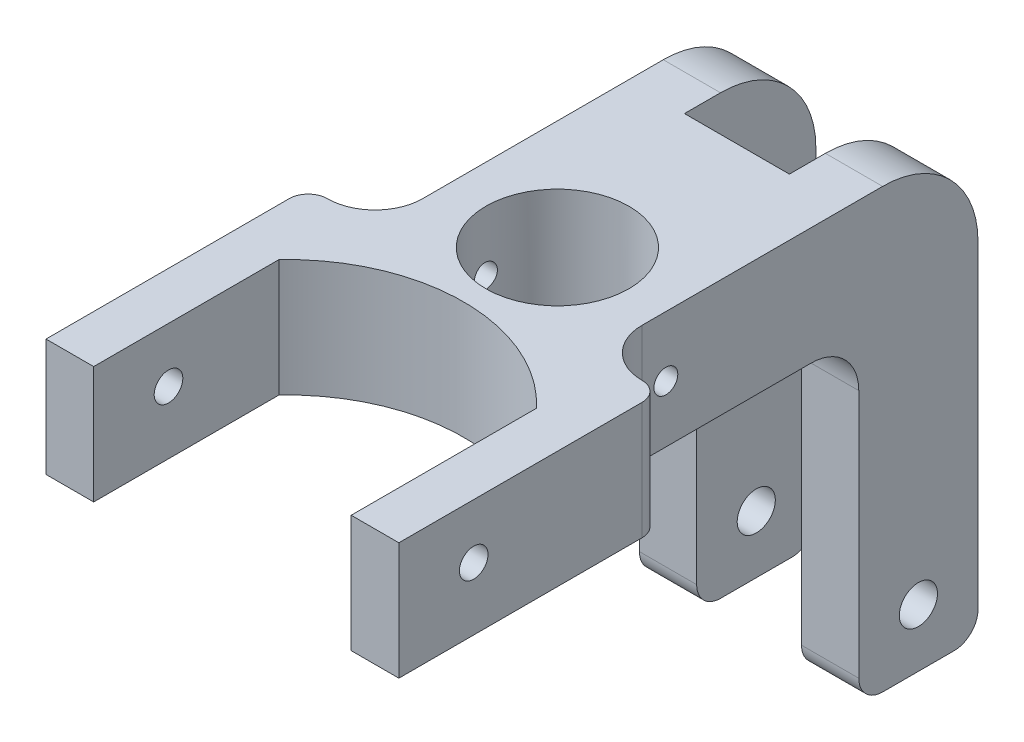
from build123d import *

# Parameters (mm, degrees)
EXTRUDE_START         = -3
EXTRUDE_1_DEPTH       = 46
SKETCH_2_R            = 15
SKETCH_2_W            = 22
SKETCH_2_H            = 41.003909118
CUT_EXTRUDE_2_DEPTH   = 120
SKETCH_3_R            = 4
SKETCH_3_R_2          = 2.5
CUT_EXTRUDE_1_DEPTH   = 55
SKETCH_4_W            = 74
SKETCH_4_H            = 24.59688775
EXTRUDE_3_DEPTH       = 55
CUT_EXTRUDE_2_2_DEPTH = 50
FILLET_2_R            = 4
SKETCH_7_R            = 3
CUT_EXTRUDE_3_DEPTH   = 90
FILLET_3_R            = 10


with BuildPart() as part:
    # Эскиз1 → Вытянуть1 (new body)
    with BuildSketch(Plane(origin=(0, 0, 0), x_dir=(0, 0, -1), z_dir=(1, 0, 0)).offset(EXTRUDE_START)):
        with BuildLine():
            Line((3.683652722, 0), (3.683652722, -24.59688775))
            Line((3.683652722, -24.59688775), (49.132150834, -24.59688775))
            ThreePointArc((49.132150834, -24.59688775), (56.203219269, -27.52582056), (59.132150834, -34.59688951))
            Line((59.132150834, -34.59688951), (59.132141638, -86.831595085))
            ThreePointArc((59.132141638, -86.831595085), (60.596607421, -90.36712956), (64.132141638, -91.831595966))
            Line((64.132141638, -91.831595966), (79.132150834, -91.831595966))
            ThreePointArc((79.132150834, -91.831595966), (82.66768474, -90.367129871), (84.132150834, -86.831595966))
            Line((84.132150834, -86.831595966), (84.132150834, -20))
            ThreePointArc((84.132150834, -20), (78.274286458, -5.857864376), (64.132150834, 0))
            Line((64.132150834, 0), (3.683652722, 0))
        make_face()
    extrude(amount=EXTRUDE_1_DEPTH)

    # Эскиз2 → Cut-Extrude 2 (cut, symmetric)
    with BuildSketch(Plane(origin=(0, 0, 0), x_dir=(1, 0, 0), z_dir=(0, 1, 0))):
        with Locations(Location((20, 18.931682227, 0), (0, 0, 270))):
            Circle(SKETCH_2_R)
        with Locations((20, 77.079487522)):
            Rectangle(SKETCH_2_W, SKETCH_2_H)
    extrude(amount=CUT_EXTRUDE_2_DEPTH, both=True, mode=Mode.SUBTRACT)

    # Эскиз3 → Вырез-Вытянуть1 (cut, symmetric)
    with BuildSketch(Plane(origin=(0, 0, 0), x_dir=(0, 0, -1), z_dir=(1, 0, 0))):
        with Locations((71.632122158, -79.695359499)):
            Circle(SKETCH_3_R)
        with Locations((18.675004926, -12.628238718)):
            Circle(SKETCH_3_R_2)
    extrude(amount=CUT_EXTRUDE_1_DEPTH, both=True, mode=Mode.SUBTRACT)

    # Эскиз4 → Вытянуть3 (add)
    with BuildSketch(Plane.XY.offset(-3.683652722)):
        with Locations((20.003387868, -12.298443875)):
            Rectangle(SKETCH_4_W, SKETCH_4_H)
    extrude(amount=EXTRUDE_3_DEPTH)

    # Эскиз6 → Cut-Extrude 2 2 (cut, symmetric)
    with BuildSketch(Plane(origin=(0, 0, 0), x_dir=(1, 0, 0), z_dir=(0, 1, 0))):
        with BuildLine():
            Line((47.003387868, -53.712819086), (47.003387868, -12.467045061))
            ThreePointArc((47.003387868, -12.467045061), (20.003387863, -0.765266352), (-6.996612132, -12.467045083))
            Line((-6.996612132, -12.467045083), (-6.996612132, -53.712819086))
            Line((-6.996612132, -53.712819086), (47.003387868, -53.712819086))
        make_face()
    extrude(amount=CUT_EXTRUDE_2_2_DEPTH, both=True, mode=Mode.SUBTRACT)

    # Скругление2
    fillet_2_edges = [part.edges().sort_by_distance(p)[0] for p in [
        (57.003387868, -12.298443875, -3.683652722),
        (-16.996612132, -12.298443875, -3.683652722),
    ]]
    fillet(fillet_2_edges, radius=FILLET_2_R)

    # Эскиз7 → Вырез-Вытянуть3 (cut, symmetric)
    with BuildSketch(Plane(origin=(57.003387868, 0, 0), x_dir=(0, 0, -1), z_dir=(1, 0, 0))):
        with Locations((-35.623538585, -11.460561108)):
            Circle(SKETCH_7_R)
    extrude(amount=CUT_EXTRUDE_3_DEPTH, both=True, mode=Mode.SUBTRACT)

    # Скругление3
    fillet_3_edges = [part.edges().sort_by_distance(p)[0] for p in [
        (-3, -12.298443875, -3.683652722),
        (43, -12.298443875, -3.683652722),
    ]]
    fillet(fillet_3_edges, radius=FILLET_3_R)


solid = part.part
